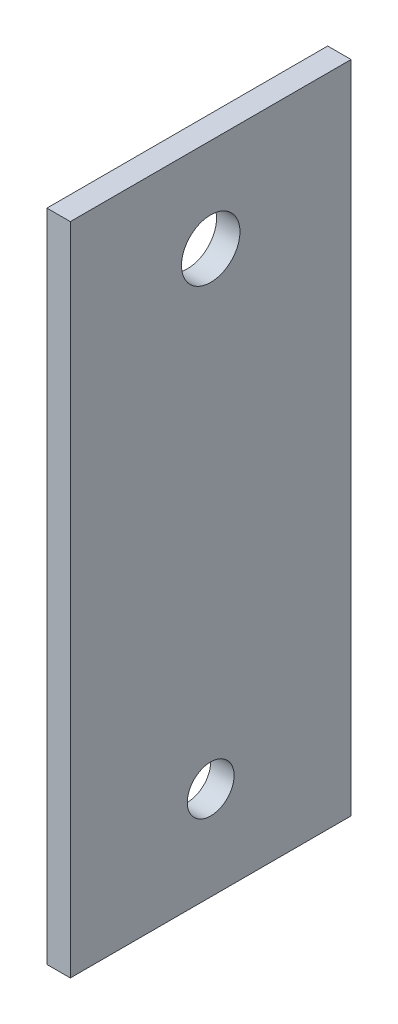
from build123d import *

# Parameters (mm, degrees)
SKETCH1_W           = 38.1
SKETCH1_H           = 88.9
SKETCH1_R           = 3.96875
SKETCH1_R_2         = 3.175
BOSS_EXTRUDE1_DEPTH = 3.175


with BuildPart() as part:
    # Sketch1 → Boss-Extrude1 (new body)
    with BuildSketch(Plane(origin=(0, 0, 0), x_dir=(0, 0, -1), z_dir=(1, 0, 0))):
        Rectangle(SKETCH1_W, SKETCH1_H)
        with Locations((0, 31.75)):
            Circle(SKETCH1_R, mode=Mode.SUBTRACT)
        with Locations((0, -31.75)):
            Circle(SKETCH1_R_2, mode=Mode.SUBTRACT)
    extrude(amount=BOSS_EXTRUDE1_DEPTH)


solid = part.part
